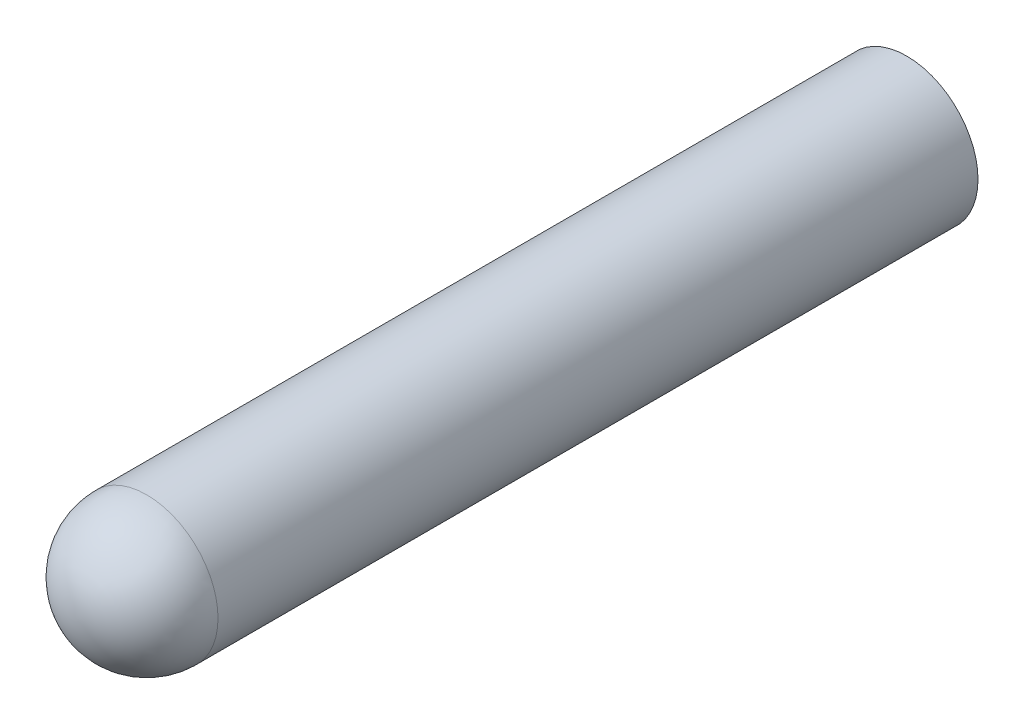
from build123d import *

# Parameters (mm, degrees)
CROQUIS2_R              = 3
SALIENTE_EXTRUIR1_DEPTH = 35
REDONDEO1_R             = 3
CROQUIS3_R              = 1.5
CORTAR_EXTRUIR1_DEPTH   = 5


with BuildPart() as part:
    # Croquis2 → Saliente-Extruir1 (new body)
    with BuildSketch(Plane.XY):
        with Locations((407.647776256, 485.203130925)):
            Circle(CROQUIS2_R)
    extrude(amount=SALIENTE_EXTRUIR1_DEPTH)

    # Redondeo1
    redondeo1_edges = [part.edges().sort_by_distance(p)[0] for p in [
        (404.647776256, 485.203130925, 35),
    ]]
    fillet(redondeo1_edges, radius=REDONDEO1_R)

    # Croquis3 → Cortar-Extruir1 (cut)
    with BuildSketch(Plane(origin=(0, 0, 0), x_dir=(-1, 0, 0), z_dir=(0, 0, -1))):
        with Locations((-407.647776256, 485.203130925)):
            Circle(CROQUIS3_R)
    extrude(amount=-CORTAR_EXTRUIR1_DEPTH, mode=Mode.SUBTRACT)


solid = part.part
